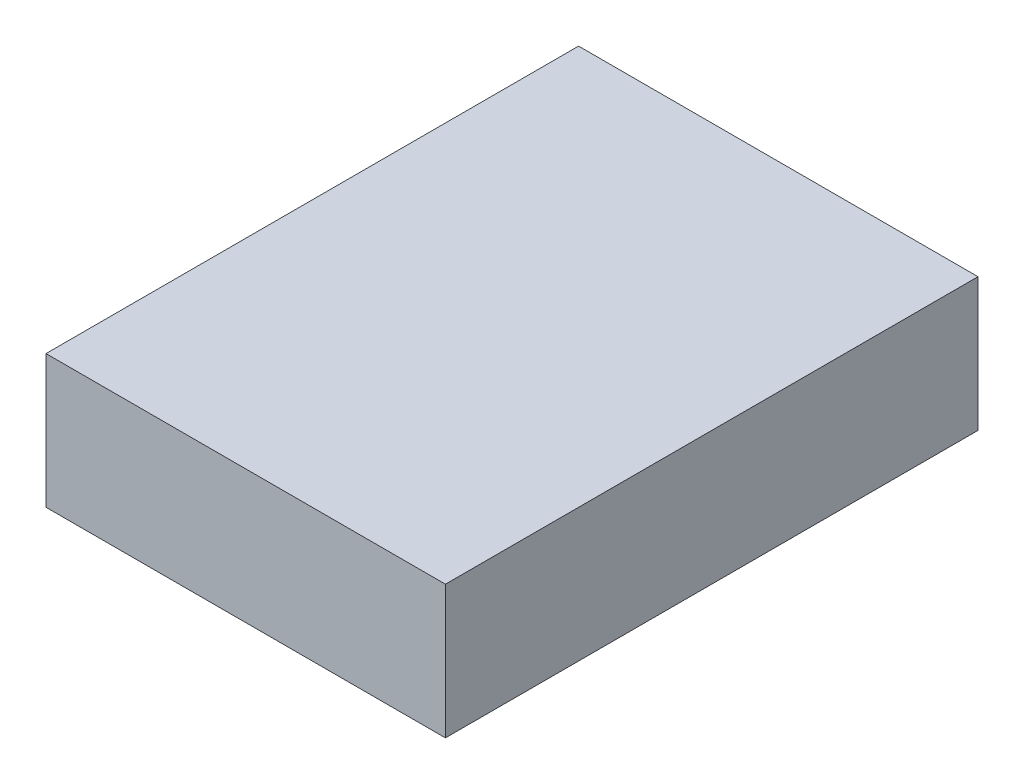
from build123d import *

# Parameters (mm, degrees)
SKETCH1_W           = 60
SKETCH1_H           = 80
BOSS_EXTRUDE2_DEPTH = 20


with BuildPart() as part:
    # Sketch1 → Boss-Extrude2 (new body)
    with BuildSketch(Plane(origin=(0, 0, 0), x_dir=(1, 0, 0), z_dir=(0, 1, 0))):
        Rectangle(SKETCH1_W, SKETCH1_H)
    extrude(amount=BOSS_EXTRUDE2_DEPTH)


solid = part.part
